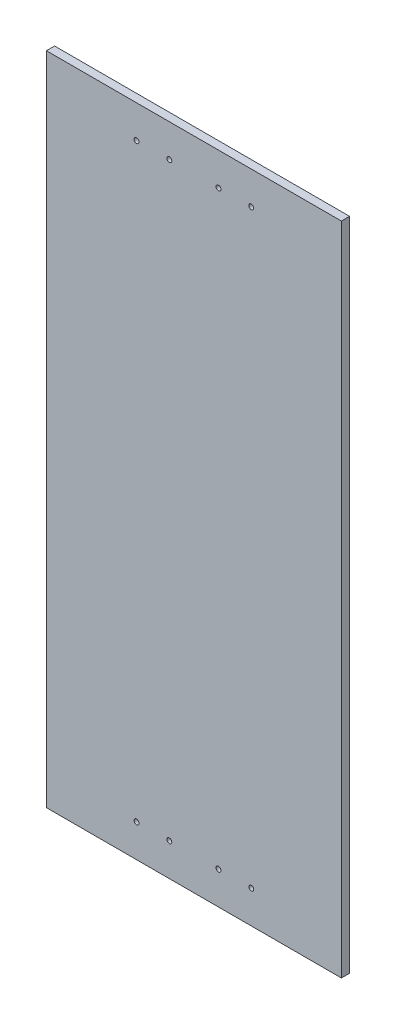
from build123d import *

# Parameters (mm, degrees)
CROQUIS1_W              = 180
CROQUIS1_H              = 400
CROQUIS1_R              = 1.5
SALIENTE_EXTRUIR1_DEPTH = 5


with BuildPart() as part:
    # Croquis1 → Saliente-Extruir1 (new body)
    with BuildSketch(Plane.XY):
        Rectangle(CROQUIS1_W, CROQUIS1_H)
        with Locations((15, -180)):
            Circle(CROQUIS1_R, mode=Mode.SUBTRACT)
        with Locations((35, -180)):
            Circle(CROQUIS1_R, mode=Mode.SUBTRACT)
        with Locations(Location((-35, -180, 0), (0, 0, 180))):
            Circle(CROQUIS1_R, mode=Mode.SUBTRACT)
        with Locations(Location((-15, -180, 0), (0, 0, 180))):
            Circle(CROQUIS1_R, mode=Mode.SUBTRACT)
        with Locations((15, 180)):
            Circle(CROQUIS1_R, mode=Mode.SUBTRACT)
        with Locations((35, 180)):
            Circle(CROQUIS1_R, mode=Mode.SUBTRACT)
        with Locations(Location((-35, 180, 0), (0, 0, 180))):
            Circle(CROQUIS1_R, mode=Mode.SUBTRACT)
        with Locations(Location((-15, 180, 0), (0, 0, 180))):
            Circle(CROQUIS1_R, mode=Mode.SUBTRACT)
    extrude(amount=SALIENTE_EXTRUIR1_DEPTH)


solid = part.part
